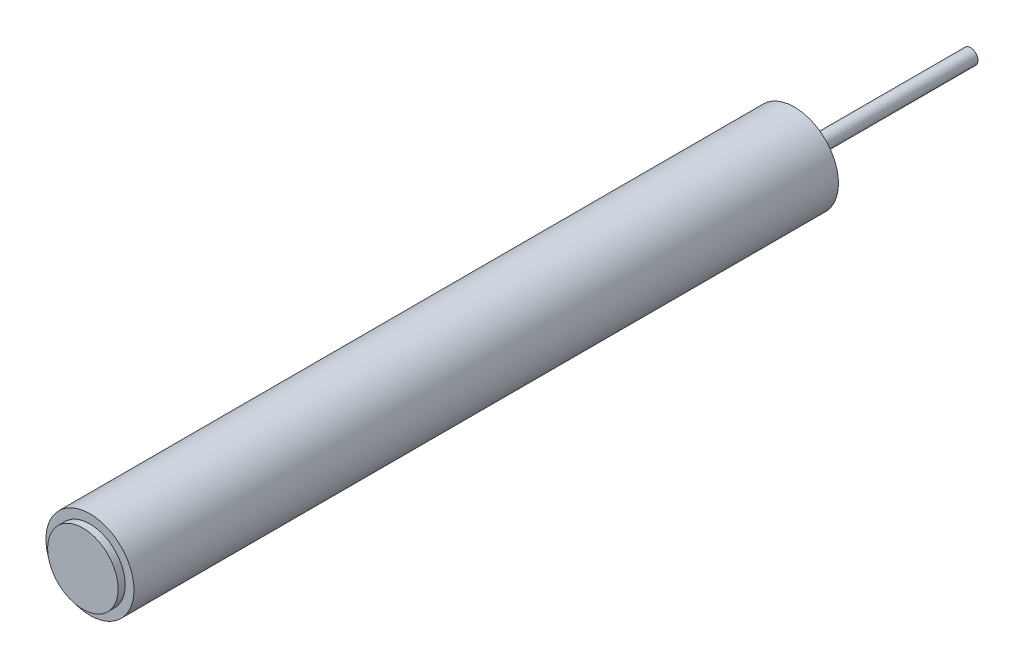
from build123d import *

# Parameters (mm, degrees)
SKETCH1_R                = 3.175
SKETCH1_R_2              = 2.54
BOSS_EXTRUDE1_DEPTH      = 50.8
BOSS_EXTRUDE2_DEPTH      = 0.508
BOSS_EXTRUDE2_DEPTH_BACK = 2.54
SKETCH2_R                = 2.54
BOSS_EXTRUDE3_START      = -48.26
SKETCH3_R                = 0.537131422
BOSS_EXTRUDE3_DEPTH      = 60.96


with BuildPart() as part:
    # Sketch1 → Boss-Extrude1 (new body)
    with BuildSketch(Plane.XY):
        Circle(SKETCH1_R)
        Circle(SKETCH1_R_2, mode=Mode.SUBTRACT)
    extrude(amount=BOSS_EXTRUDE1_DEPTH)

    # Sketch2 → Boss-Extrude2 (add, two sides: drawn at the far end of the back side and taken through both)
    with BuildSketch(Plane.XY.offset(50.8).offset(-BOSS_EXTRUDE2_DEPTH_BACK)):
        Circle(SKETCH2_R)
    extrude(amount=BOSS_EXTRUDE2_DEPTH + BOSS_EXTRUDE2_DEPTH_BACK)

    # Sketch3 → Boss-Extrude3 (add)
    with BuildSketch(Plane(origin=(0, 0, 0), x_dir=(-1, 0, 0), z_dir=(0, 0, -1)).offset(BOSS_EXTRUDE3_START)):
        with Locations(Location((0, 0, 0), (0, 0, 180))):
            Circle(SKETCH3_R)
    extrude(amount=BOSS_EXTRUDE3_DEPTH)


solid = part.part
